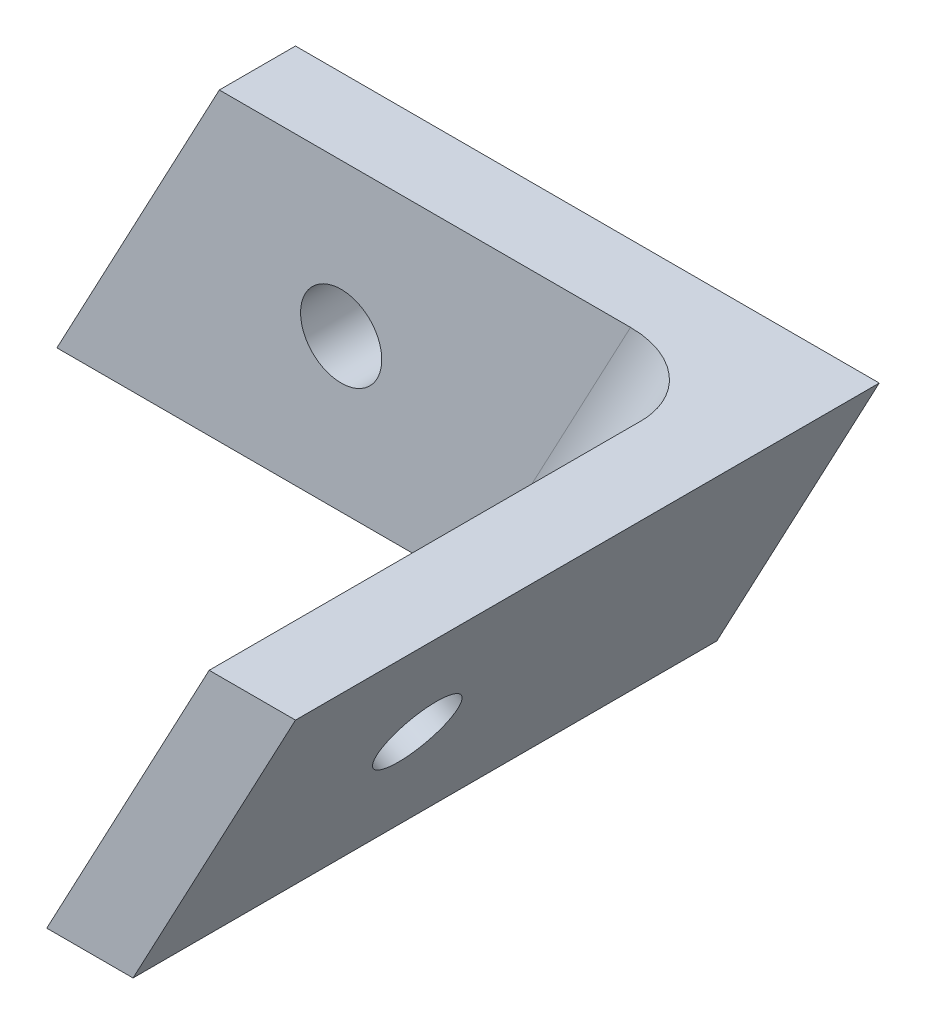
from build123d import *

# Parameters (mm, degrees)
EXTRUDE_1_DEPTH     = 3
EXTRUDE_2_DEPTH     = 20
CUT_EXTRUDE_1_REACH = 86.581
SKETCH_3_R          = 1.6
CUT_EXTRUDE_2_REACH = 57.839
SKETCH_4_R          = 1.6
FILLET_1_R          = 3


with BuildPart() as part:
    # 草图1 → 凸台-拉伸1 (new body)
    with BuildSketch(Plane.XY):
        Polygon((57, 15), (80, 15), (73.6, 3), (50.6, 3), align=None)
    extrude(amount=EXTRUDE_1_DEPTH)

    # 草图2 → 凸台-拉伸2 (add)
    with BuildSketch(Plane.XY.offset(3)):
        Polygon((76.6, 15), (80, 15), (73.6, 3), (70.2, 3), align=None)
    extrude(amount=EXTRUDE_2_DEPTH)

    # 草图3 → 切除-拉伸1 (cut, up to next)
    with BuildSketch(Plane.XY, mode=Mode.PRIVATE) as cut_extrude_1_sk1:
        with Locations(Location((61.8, 9, 0), (0, 0, 180))):
            Circle(SKETCH_3_R)
    cut_extrude_1_tool1 = extrude(cut_extrude_1_sk1.sketch, amount=CUT_EXTRUDE_1_REACH, mode=Mode.PRIVATE) & part.part
    add(cut_extrude_1_tool1.solids().sort_by_distance((61.8, 9, 0))[0], mode=Mode.SUBTRACT)

    # 草图4 → 切除-拉伸2 (cut, up to next)
    with BuildSketch(Plane(origin=(56.055363322, -29.896193772, 0), x_dir=(0, 0, 1), z_dir=(-0.8823529411764705, 0.470588235294118, 0)), mode=Mode.PRIVATE) as cut_extrude_2_sk1:
        with Locations(Location((15, 44.082352941, 0), (0, 0, 90))):
            Circle(SKETCH_4_R)
    cut_extrude_2_tool1 = extrude(cut_extrude_2_sk1.sketch, amount=CUT_EXTRUDE_2_REACH, mode=Mode.PRIVATE) & part.part
    add(cut_extrude_2_tool1.solids().sort_by_distance((76.8, 9, 15))[0], mode=Mode.SUBTRACT)

    # 圆角1
    fillet_1_edges = [part.edges().sort_by_distance(p)[0] for p in [
        (73.4, 9, 3),
    ]]
    fillet(fillet_1_edges, radius=FILLET_1_R)


solid = part.part
